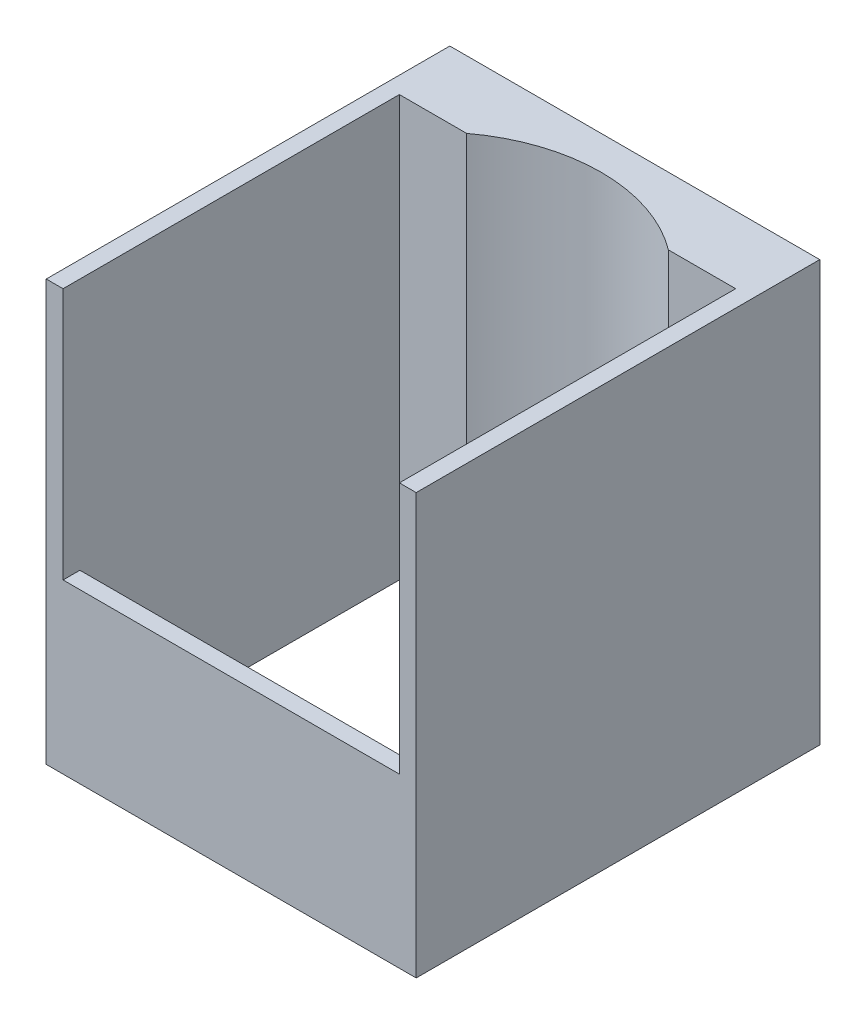
from build123d import *

# Parameters (mm, degrees)
SKETCH1_W                      = 670
SKETCH1_H                      = 120
BOSS_EXTRUDE1_DEPTH            = 530
SKETCH2_W                      = 100
SKETCH2_H                      = 200
SKETCH2_W_2                    = 650
SKETCH2_H_2                    = 250
CUT_EXTRUDE1_DEPTH             = 100
SKETCH3_R                      = 50
CUT_EXTRUDE2_DEPTH             = 260
F_12_0_12_DIAMETER_HOLE2_D     = 12
F_12_0_12_DIAMETER_HOLE2_DEPTH = 30
F_12_0_12_DIAMETER_HOLE2_TIP   = 3.605163714
SKETCH8_W                      = 650
SKETCH8_H                      = 50
BOSS_EXTRUDE2_DEPTH            = 5
SKETCH9_W                      = 10
SKETCH9_H                      = 250
CUT_EXTRUDE3_DEPTH             = 717
CUT_EXTRUDE4_DEPTH             = 5
SKETCH11_W                     = 10
SKETCH11_H                     = 100
BOSS_EXTRUDE3_DEPTH            = 78
BOSS_EXTRUDE3_2_DEPTH          = 78
BOSS_EXTRUDE3_3_DEPTH          = 78
SKETCH12_W                     = 20
SKETCH12_H                     = 30
CUT_EXTRUDE5_DEPTH             = 80
SKETCH15_W                     = 30
SKETCH15_H                     = 23.536156656
SKETCH15_H_2                   = 28.986603691
CUT_EXTRUDE7_DEPTH             = 35
SHELL1_T                       = -3
SKETCH16_W                     = 14
SKETCH16_H                     = 14
CUT_EXTRUDE8_DEPTH             = 35
SKETCH17_W                     = 5.729882812
SKETCH17_H                     = 17.428393554
SKETCH17_W_2                   = 13.369726562
SKETCH17_H_2                   = 3.342431641
BOSS_EXTRUDE4_DEPTH            = 5
SKETCH18_W                     = 670
SKETCH18_H                     = 280
CUT_EXTRUDE10_DEPTH            = 159
CUT_EXTRUDE11_DEPTH            = 863.670273187
CUT_EXTRUDE11_DEPTH_BACK       = 863.670273187
SKETCH19_W                     = 115
SKETCH19_H                     = 250
SKETCH19_W_2                   = 445
CUT_EXTRUDE12_DEPTH            = 589.153891426
CUT_EXTRUDE12_DEPTH_BACK       = 589.153891426
SKETCH20_W                     = 110
SKETCH20_H                     = 125


with BuildPart() as part:
    # Sketch1 → Boss-Extrude1 (new body)
    with BuildSketch(Plane(origin=(0, 0, 0), x_dir=(1, 0, 0), z_dir=(0, 1, 0))):
        with Locations((335, 60)):
            Rectangle(SKETCH1_W, SKETCH1_H)
    extrude(amount=BOSS_EXTRUDE1_DEPTH)

    # Sketch2 → Cut-Extrude1 (cut)
    with BuildSketch(Plane.XY):
        with Locations((60, 380)):
            Rectangle(SKETCH2_W, SKETCH2_H)
        with Locations((170, 380)):
            Rectangle(SKETCH2_W, SKETCH2_H)
        with Locations((280, 380)):
            Rectangle(SKETCH2_W, SKETCH2_H)
        with Locations((390, 380)):
            Rectangle(SKETCH2_W, SKETCH2_H)
        with Locations((500, 380)):
            Rectangle(SKETCH2_W, SKETCH2_H)
        with Locations((610, 380)):
            Rectangle(SKETCH2_W, SKETCH2_H)
        with Locations((335, 135)):
            Rectangle(SKETCH2_W_2, SKETCH2_H_2)
    extrude(amount=-CUT_EXTRUDE1_DEPTH, mode=Mode.SUBTRACT)

    # Sketch3 → Cut-Extrude2 (cut)
    with BuildSketch(Plane(origin=(0, 530, 0), x_dir=(1, 0, 0), z_dir=(0, 1, 0))):
        with Locations(Location((60, 60, 0), (0, 0, 270))):
            Circle(SKETCH3_R)
        with Locations(Location((170, 60, 0), (0, 0, 270))):
            Circle(SKETCH3_R)
        with Locations(Location((280, 60, 0), (0, 0, 270))):
            Circle(SKETCH3_R)
        with Locations(Location((390, 60, 0), (0, 0, 270))):
            Circle(SKETCH3_R)
        with Locations(Location((500, 60, 0), (0, 0, 270))):
            Circle(SKETCH3_R)
        with Locations(Location((610, 60, 0), (0, 0, 270))):
            Circle(SKETCH3_R)
    extrude(amount=-CUT_EXTRUDE2_DEPTH, mode=Mode.SUBTRACT)

    # Ø12.0 (12) Diameter Hole2
    with Locations(Plane(origin=(59.704642413, 270, -102.411697903), x_dir=(0, 0, 1), z_dir=(0, 1, 0))):
        with Locations((0, 0), (-0.195888006, 111.8520513), (0.014838595, 221.167624818), (-0.341843303, 331.364008353), (0.657723149, 441.008646429), (1.288998006, 549.811854685)):
            Hole(F_12_0_12_DIAMETER_HOLE2_D / 2, depth=F_12_0_12_DIAMETER_HOLE2_DEPTH)
            with Locations((0, 0, -(F_12_0_12_DIAMETER_HOLE2_DEPTH + F_12_0_12_DIAMETER_HOLE2_TIP / 2))):  # 118° drill point
                Cone(0, F_12_0_12_DIAMETER_HOLE2_D / 2, F_12_0_12_DIAMETER_HOLE2_TIP, mode=Mode.SUBTRACT)

    # Sketch8 → Boss-Extrude2 (add)
    with BuildSketch(Plane.XY):
        with Locations((335, 305)):
            Rectangle(SKETCH8_W, SKETCH8_H)
    extrude(amount=-BOSS_EXTRUDE2_DEPTH)

    # Sketch9 → Cut-Extrude3 (cut)
    with BuildSketch(Plane(origin=(670, 0, 0), x_dir=(0, 0, -1), z_dir=(1, 0, 0))):
        with Locations((15, 135)):
            Rectangle(SKETCH9_W, SKETCH9_H)
    extrude(amount=-CUT_EXTRUDE3_DEPTH, mode=Mode.SUBTRACT)

    # Sketch10 → Cut-Extrude4 (cut)
    with BuildSketch(Plane(origin=(0, 10, 0), x_dir=(1, 0, 0), z_dir=(0, 1, 0))):
        Polygon((365, 61.943560596), (350, 87.924322709), (320, 87.924322709), (305, 61.943560596), (320, 35.962798482), (350, 35.962798482), align=None)
    extrude(amount=-CUT_EXTRUDE4_DEPTH, mode=Mode.SUBTRACT)

    # Sketch12 → Cut-Extrude5 (cut)
    with BuildSketch(Plane.XY.offset(-100)):
        with Locations((85.198613037, 245)):
            Rectangle(SKETCH12_W, SKETCH12_H)
        with Locations((195.198613037, 245)):
            Rectangle(SKETCH12_W, SKETCH12_H)
        with Locations((305.198613037, 245)):
            Rectangle(SKETCH12_W, SKETCH12_H)
        with Locations((415.198613037, 245)):
            Rectangle(SKETCH12_W, SKETCH12_H)
        with Locations((525.198613037, 245)):
            Rectangle(SKETCH12_W, SKETCH12_H)
        with Locations((635.198613037, 245)):
            Rectangle(SKETCH12_W, SKETCH12_H)
    extrude(amount=-CUT_EXTRUDE5_DEPTH, mode=Mode.SUBTRACT)

    # Sketch17 → Boss-Extrude4 (add)
    # profile 1 of 9: a face of its own
    with BuildSketch(Plane.XY):
        with BuildLine():
            Line((527.508830928, 289.835452458), (527.508830928, 307.263846012))
            Line((527.508830928, 307.263846012), (534.861434459, 307.263846012))
            add(Edge.make_bspline(
                [(534.861434459, 307.263846012), (535.181337774, 307.258256848), (535.803061116, 307.24739446), (536.703508491, 307.139069344), (537.544992916, 306.975202489), (538.325061607, 306.737496792), (539.040841948, 306.426020155), (539.698044515, 306.051894954), (540.290333057, 305.605079277), (540.822348212, 305.090232636), (541.284521701, 304.502523111), (541.692171296, 303.852565801), (542.030284458, 303.129762281), (542.309377095, 302.341316546), (542.5243908, 301.484161689), (542.679660381, 300.560045938), (542.773357357, 299.567500804), (542.783368073, 298.883107022), (542.788518428, 298.530997273)],
                knots=[0, 0, 0, 0, 1.135059408, 2.20595691, 3.214417064, 4.174978569, 5.094187092, 5.980001006, 6.853065862, 7.720814779, 8.600404634, 9.50058483, 10.438414914, 11.426825708, 12.465239141, 13.571113463, 14.750376389, 16, 16, 16, 16], degree=3))
            add(Edge.make_bspline(
                [(542.788518428, 298.530997273), (542.781740751, 298.180151665), (542.768592871, 297.499553336), (542.676885992, 296.511518461), (542.516733301, 295.591080531), (542.296748778, 294.736450427), (542.003051046, 293.953120444), (541.654236167, 293.233205539), (541.233025793, 292.585291498), (540.753136904, 292.000029304), (540.204772188, 291.484681411), (539.587651059, 291.044279297), (538.910779309, 290.668464036), (538.169670382, 290.361903209), (537.364073889, 290.124869172), (536.495133477, 289.954199984), (535.562644449, 289.853487388), (534.920131033, 289.841584621), (534.58911581, 289.835452458)],
                knots=[0, 0, 0, 0, 1.228418252, 2.382983832, 3.470276728, 4.496757894, 5.468023682, 6.394867725, 7.292157164, 8.167372942, 9.039072913, 9.918728341, 10.815246345, 11.744296628, 12.720973084, 13.750736166, 14.841206188, 16, 16, 16, 16], degree=3))
            Line((534.58911581, 289.835452458), (527.508830928, 289.835452458))
        make_face()
        with BuildLine():
            Line((533.238713741, 291.745413395), (534.048208904, 291.745413395))
            add(Edge.make_bspline(
                [(534.048208904, 291.745413395), (534.172894012, 291.749291978), (534.413033311, 291.756761998), (534.758676231, 291.825976613), (535.075745017, 291.938271137), (535.365749176, 292.094802589), (535.623404602, 292.300450923), (535.848862806, 292.551404902), (536.04776914, 292.844737637), (536.217685755, 293.190205032), (536.364284647, 293.596533622), (536.481764702, 294.076367921), (536.592118304, 294.630928744), (536.673672739, 295.265507643), (536.740044562, 295.978448886), (536.788346679, 296.768428292), (536.812018936, 297.636801208), (536.817188964, 298.241258393), (536.819890499, 298.55711002)],
                knots=[0, 0, 0, 0, 0.728710832, 1.403472396, 2.052289494, 2.690292559, 3.321919393, 3.970736491, 4.656696891, 5.388631723, 6.217040872, 7.17856157, 8.275589967, 9.523440737, 10.918935818, 12.463926104, 14.152268318, 16, 16, 16, 16], degree=3))
            add(Edge.make_bspline(
                [(536.819890499, 298.55711002), (536.8171426, 298.871715251), (536.811863063, 299.476166083), (536.7886758, 300.343334385), (536.739579947, 301.133216935), (536.674703848, 301.843934916), (536.589660404, 302.476324031), (536.488366458, 303.031681737), (536.362441588, 303.507627045), (536.222158727, 303.914921549), (536.050140993, 304.256514038), (535.858357073, 304.554097881), (535.62547107, 304.79746827), (535.36991257, 305.004888479), (535.079348843, 305.160875844), (534.761320266, 305.273944358), (534.414185903, 305.34216807), (534.172870641, 305.349893944), (534.048208904, 305.353885075)],
                knots=[0, 0, 0, 0, 1.842836665, 3.540640921, 5.080358154, 6.47765669, 7.719902824, 8.816971715, 9.781579111, 10.601733135, 11.334613876, 12.017393917, 12.666641099, 13.29908421, 13.937911793, 14.587567384, 15.270347425, 16, 16, 16, 16], degree=3))
            Line((534.048208904, 305.353885075), (533.238713741, 305.353885075))
            Line((533.238713741, 305.353885075), (533.238713741, 291.745413395))
        make_face(mode=Mode.SUBTRACT)
    # profile 2 of 9: a face of its own
    with BuildSketch(Plane.XY):
        with Locations((547.563420772, 298.549649235)):
            Rectangle(SKETCH17_W, SKETCH17_H)
    # profile 3 of 9: a face of its own
    with BuildSketch(Plane.XY):
        Polygon((564.514324092, 307.263846012), (564.514324092, 305.115139958), (558.545696163, 305.115139958), (558.545696163, 299.862747379), (563.559343624, 299.862747379), (563.559343624, 297.714041325), (558.545696163, 297.714041325), (558.545696163, 289.835452458), (552.81581335, 289.835452458), (552.81581335, 307.263846012), align=None)
    # profile 4 of 9: a face of its own
    with BuildSketch(Plane.XY):
        Polygon((577.645305538, 307.263846012), (577.645305538, 305.115139958), (571.676677608, 305.115139958), (571.676677608, 299.862747379), (576.690325069, 299.862747379), (576.690325069, 297.714041325), (571.676677608, 297.714041325), (571.676677608, 289.835452458), (565.946794795, 289.835452458), (565.946794795, 307.263846012), align=None)
    # profile 5 of 9: a face of its own
    with BuildSketch(Plane.XY):
        with Locations((584.330168819, 287.448001286)):
            Rectangle(SKETCH17_W_2, SKETCH17_H_2)
    # profile 6 of 9: a face of its own
    with BuildSketch(Plane.XY):
        with BuildLine():
            Line((605.578484249, 307.263846012), (605.578484249, 295.602639195))
            add(Edge.make_bspline(
                [(605.578484249, 295.602639195), (605.574209777, 295.35989389), (605.565919345, 294.889083964), (605.480877158, 294.20653885), (605.349958188, 293.569747554), (605.15926554, 292.978838165), (604.911867049, 292.436847071), (604.616163877, 291.936663973), (604.260702644, 291.487723021), (603.847299908, 291.08966617), (603.386881991, 290.731670113), (602.867295001, 290.425440037), (602.293741958, 290.168488385), (601.66690529, 289.960990771), (600.988052682, 289.797299786), (600.254912883, 289.679078851), (599.467035781, 289.60781007), (598.923618241, 289.60048219), (598.643684673, 289.59670734)],
                knots=[0, 0, 0, 0, 1.108173197, 2.149326602, 3.136215123, 4.073726706, 4.978516626, 5.852185058, 6.72141202, 7.584905625, 8.467554395, 9.379216169, 10.332422268, 11.332766067, 12.390653242, 13.518530507, 14.721707419, 16, 16, 16, 16], degree=3))
            add(Edge.make_bspline(
                [(598.643684673, 289.59670734), (598.373688491, 289.600411437), (597.851346557, 289.607577482), (597.093280473, 289.679448684), (596.387523889, 289.797736542), (595.733050135, 289.960122315), (595.130189942, 290.169220301), (594.579048171, 290.42623041), (594.078350789, 290.732835498), (593.633858028, 291.090104794), (593.234289459, 291.486851767), (592.899913678, 291.940746827), (592.609043638, 292.435866034), (592.375223767, 292.980322997), (592.191754821, 293.570441519), (592.063541006, 294.20666921), (591.983676196, 294.889343196), (591.974661767, 295.359932437), (591.970012569, 295.602639195)],
                knots=[0, 0, 0, 0, 1.258901956, 2.435505865, 3.547148904, 4.59359074, 5.576649289, 6.5183682, 7.424469602, 8.307507093, 9.172751023, 10.042627298, 10.928839176, 11.845659241, 12.799442865, 13.80597989, 14.868432463, 16, 16, 16, 16], degree=3))
            Line((591.970012569, 295.602639195), (591.970012569, 307.263846012))
            Line((591.970012569, 307.263846012), (597.699895381, 307.263846012))
            Line((597.699895381, 307.263846012), (597.699895381, 295.457153889))
            add(Edge.make_bspline(
                [(597.699895381, 295.457153889), (597.700816195, 295.287996189), (597.702584578, 294.963135903), (597.729908723, 294.499051493), (597.768241004, 294.079064133), (597.828226169, 293.705517832), (597.90066041, 293.377063412), (597.989882091, 293.09281535), (598.094998068, 292.852496478), (598.225239063, 292.654232043), (598.380826623, 292.495135011), (598.55368342, 292.353231761), (598.757556996, 292.238543846), (598.987648905, 292.146224908), (599.243380948, 292.070549638), (599.526120553, 292.020376099), (599.83553351, 291.990763905), (600.049971942, 291.986424568), (600.161954402, 291.984158512)],
                knots=[0, 0, 0, 0, 1.622370975, 3.115695595, 4.458049099, 5.666011203, 6.742434742, 7.681714947, 8.519814998, 9.250928664, 9.942747364, 10.646898194, 11.389596108, 12.175933929, 13.021386247, 13.943159715, 14.925891993, 16, 16, 16, 16], degree=3))
            add(Edge.make_bspline(
                [(600.161954402, 291.984158512), (600.283927219, 291.987190593), (600.521124756, 291.993087005), (600.86597014, 292.03390861), (601.187714881, 292.103380086), (601.484890424, 292.205377303), (601.758665297, 292.332852529), (602.012761516, 292.484567923), (602.236391413, 292.674631152), (602.439076761, 292.888441291), (602.620738276, 293.128529789), (602.771757722, 293.399928575), (602.905501548, 293.697121508), (603.005823683, 294.025060118), (603.089837826, 294.379999499), (603.146989706, 294.763086929), (603.186210275, 295.174074524), (603.189394751, 295.457053988), (603.191033077, 295.602639195)],
                knots=[0, 0, 0, 0, 1.083870311, 2.107775948, 3.08105344, 4.003637981, 4.893545291, 5.761570557, 6.624657808, 7.49233129, 8.376387281, 9.291996285, 10.246843261, 11.267344133, 12.334180325, 13.486053461, 14.706643157, 16, 16, 16, 16], degree=3))
            Line((603.191033077, 295.602639195), (603.191033077, 307.263846012))
            Line((603.191033077, 307.263846012), (605.578484249, 307.263846012))
        make_face()
    # profile 7 of 9: a face of its own
    with BuildSketch(Plane.XY):
        with BuildLine():
            Line((619.731593227, 302.015183827), (616.739818477, 301.526502415))
            add(Edge.make_bspline(
                [(616.739818477, 301.526502415), (616.748849224, 301.670726223), (616.765660669, 301.939210177), (616.78429066, 302.312269209), (616.796668381, 302.625642376), (616.798628236, 302.814722915), (616.799504756, 302.899286839)],
                knots=[0, 0, 0, 0, 1.261802504, 2.348944521, 3.261585937, 4, 4, 4, 4], degree=3))
            add(Edge.make_bspline(
                [(616.799504756, 302.899286839), (616.798306068, 303.007660677), (616.795968139, 303.219033721), (616.750451916, 303.523894877), (616.694806916, 303.811547356), (616.604352699, 304.076787391), (616.488181329, 304.320314265), (616.348943917, 304.543955606), (616.184187178, 304.745078709), (615.995833421, 304.928129987), (615.778009957, 305.083200131), (615.536269472, 305.218702836), (615.269765326, 305.333844758), (614.978065514, 305.431346685), (614.660683072, 305.504624438), (614.319025281, 305.556776695), (613.952471696, 305.585673441), (613.699597795, 305.590260771), (613.568984889, 305.592630192)],
                knots=[0, 0, 0, 0, 1.079280541, 2.105035848, 3.067950317, 3.99715044, 4.889989748, 5.753421302, 6.617030865, 7.476358039, 8.364190572, 9.274590025, 10.235106994, 11.254473582, 12.337095886, 13.478601727, 14.697662529, 16, 16, 16, 16], degree=3))
            add(Edge.make_bspline(
                [(613.568984889, 305.592630192), (613.391954632, 305.58912286), (613.059112606, 305.582528579), (612.595688488, 305.495339748), (612.198743126, 305.361419257), (611.87165349, 305.163811893), (611.613188167, 304.909795747), (611.433841092, 304.593316589), (611.323009072, 304.224665915), (611.313400221, 303.959558324), (611.308367061, 303.820693775)],
                knots=[0, 0, 0, 0, 1.294917039, 2.43462794, 3.440028966, 4.347597256, 5.210608309, 6.06356377, 6.985685997, 8, 8, 8, 8], degree=3))
            add(Edge.make_bspline(
                [(611.308367061, 303.820693775), (611.317562032, 303.705133219), (611.336106628, 303.472068433), (611.47315858, 303.132808312), (611.695999602, 302.811560885), (612.009295906, 302.510664216), (612.404107796, 302.221967273), (612.884407504, 301.948533431), (613.450813789, 301.688189695), (613.862519081, 301.536023727), (614.080048656, 301.455624958)],
                knots=[0, 0, 0, 0, 0.716839541, 1.445735977, 2.240793036, 3.131329288, 4.131129903, 5.273471266, 6.559404876, 8, 8, 8, 8], degree=3))
            add(Edge.make_bspline(
                [(614.080048656, 301.455624958), (614.335934702, 301.364918412), (614.834564244, 301.188164095), (615.547657928, 300.88707802), (616.213068388, 300.5749594), (616.829579094, 300.246613346), (617.397833174, 299.90520698), (617.914851624, 299.544556457), (618.386199073, 299.173962102), (618.807001026, 298.783874588), (619.177995113, 298.378100064), (619.4958685, 297.952745357), (619.771807525, 297.51723103), (619.991113975, 297.061458502), (620.169645242, 296.594624218), (620.292698657, 296.11024444), (620.364288243, 295.609761088), (620.37516617, 295.270864226), (620.380681514, 295.099036213)],
                knots=[0, 0, 0, 0, 1.359488612, 2.649152603, 3.874964776, 5.039588756, 6.146130126, 7.193090393, 8.194917302, 9.146793662, 10.063845301, 10.944476293, 11.803344532, 12.641736646, 13.473440096, 14.302714936, 15.139439897, 16, 16, 16, 16], degree=3))
            add(Edge.make_bspline(
                [(620.380681514, 295.099036213), (620.374476075, 294.902306495), (620.362285176, 294.515820995), (620.280160209, 293.948630617), (620.138011896, 293.409496554), (619.938489338, 292.895972278), (619.681049879, 292.411946655), (619.366518754, 291.954381076), (618.996510229, 291.525099427), (618.5710008, 291.128381035), (618.102222518, 290.765302239), (617.587803957, 290.450854345), (617.034458515, 290.187092261), (616.444107988, 289.968993032), (615.81453624, 289.801373099), (615.145337453, 289.685291013), (614.438790193, 289.606619894), (613.954683001, 289.600062276), (613.70700941, 289.59670734)],
                knots=[0, 0, 0, 0, 0.972121714, 1.909782367, 2.824924061, 3.721832975, 4.62620438, 5.527836938, 6.46026819, 7.421000932, 8.398101015, 9.385579713, 10.394244048, 11.422703992, 12.491421888, 13.608778581, 14.776629625, 16, 16, 16, 16], degree=3))
            add(Edge.make_bspline(
                [(613.70700941, 289.59670734), (613.445745367, 289.599650312), (612.939893069, 289.605348413), (612.207608113, 289.66709241), (611.525297432, 289.760984454), (610.893395078, 289.899706116), (610.309273131, 290.072394336), (609.776099392, 290.288320955), (609.295310255, 290.547303481), (608.863217672, 290.843007892), (608.478306623, 291.175775461), (608.148120946, 291.551766865), (607.86942369, 291.967163224), (607.639947144, 292.421521488), (607.466477665, 292.917583541), (607.339164663, 293.449829748), (607.264537999, 294.021332449), (607.254747521, 294.414908557), (607.249700069, 294.617815586)],
                knots=[0, 0, 0, 0, 1.342201143, 2.598733168, 3.773451092, 4.878874364, 5.91991243, 6.900006476, 7.829142054, 8.72062616, 9.585588575, 10.436728592, 11.283829734, 12.149664931, 13.044964919, 13.977937424, 14.957531465, 16, 16, 16, 16], degree=3))
            add(Edge.make_bspline(
                [(607.249700069, 294.617815586), (607.250803815, 294.692425759), (607.253213998, 294.855347393), (607.260452266, 295.122772538), (607.275636683, 295.433682216), (607.29037174, 295.656130545), (607.298195171, 295.774237248)],
                knots=[0, 0, 0, 0, 0.773500207, 1.689044709, 2.77302154, 4, 4, 4, 4], degree=3))
            Line((607.298195171, 295.774237248), (610.36457777, 296.337526509))
            add(Edge.make_bspline(
                [(610.36457777, 296.337526509), (610.326952988, 296.136337493), (610.255606535, 295.754830366), (610.178678473, 295.21219969), (610.124206629, 294.733311493), (610.11767002, 294.435147371), (610.114641475, 294.297001835)],
                knots=[0, 0, 0, 0, 1.192988372, 2.262218769, 3.194850416, 4, 4, 4, 4], degree=3))
            add(Edge.make_bspline(
                [(610.114641475, 294.297001835), (610.116191817, 294.183708768), (610.119182568, 293.965156219), (610.159053378, 293.648552813), (610.215988606, 293.352999663), (610.302906772, 293.079707227), (610.411206928, 292.826307836), (610.544682453, 292.59538211), (610.704385489, 292.386485019), (610.887496571, 292.200099922), (611.094689168, 292.033628705), (611.327456494, 291.892756696), (611.58347653, 291.771733922), (611.864681562, 291.677479524), (612.167961721, 291.596080628), (612.497219749, 291.548235723), (612.849461228, 291.512043782), (613.092629543, 291.508500084), (613.218327999, 291.506668278)],
                knots=[0, 0, 0, 0, 1.135776692, 2.191015738, 3.19649269, 4.151244236, 5.061952528, 5.956281389, 6.819534407, 7.692823504, 8.571441916, 9.478554956, 10.416037156, 11.406231466, 12.450054172, 13.561596327, 14.739541482, 16, 16, 16, 16], degree=3))
            add(Edge.make_bspline(
                [(613.218327999, 291.506668278), (613.423996012, 291.510791273), (613.810619321, 291.518541853), (614.349272542, 291.616708407), (614.810575885, 291.768742445), (615.189785268, 291.991387532), (615.490778961, 292.278756613), (615.698005174, 292.637320004), (615.824813318, 293.05638326), (615.837728413, 293.355975238), (615.844524288, 293.513619419)],
                knots=[0, 0, 0, 0, 1.308765556, 2.460272085, 3.475015317, 4.388076298, 5.239673503, 6.095681635, 6.997954785, 8, 8, 8, 8], degree=3))
            add(Edge.make_bspline(
                [(615.844524288, 293.513619419), (615.833808824, 293.638242951), (615.811807312, 293.894126055), (615.644884004, 294.264515838), (615.382382362, 294.620631473), (615.016807277, 294.962984909), (614.551376589, 295.293471235), (613.986957743, 295.616730224), (613.322148235, 295.933112033), (612.83677959, 296.119639164), (612.580430889, 296.21815395)],
                knots=[0, 0, 0, 0, 0.667930748, 1.371427933, 2.146459016, 3.034714139, 4.04893387, 5.207327294, 6.525042705, 8, 8, 8, 8], degree=3))
            add(Edge.make_bspline(
                [(612.580430889, 296.21815395), (612.374354345, 296.29679374), (611.970646869, 296.450850434), (611.394079385, 296.713586304), (610.853066711, 296.987016804), (610.357486361, 297.288235735), (609.896382561, 297.599610528), (609.477036946, 297.932256792), (609.09841673, 298.284556341), (608.758710772, 298.653375077), (608.457302107, 299.038989264), (608.199448649, 299.444659231), (607.977533299, 299.866789834), (607.798609588, 300.308107488), (607.65975715, 300.767821241), (607.559616231, 301.244439392), (607.497905054, 301.739995674), (607.491630423, 302.075933546), (607.488445186, 302.246468159)],
                knots=[0, 0, 0, 0, 1.249558333, 2.447906163, 3.58867143, 4.682264114, 5.731748367, 6.739728761, 7.711906036, 8.659384707, 9.578321416, 10.481344598, 11.379544271, 12.277135726, 13.175418307, 14.097160112, 15.034047388, 16, 16, 16, 16], degree=3))
            add(Edge.make_bspline(
                [(607.488445186, 302.246468159), (607.49282555, 302.439538736), (607.501402184, 302.817565692), (607.587451154, 303.36980586), (607.719291893, 303.894921371), (607.910558542, 304.389343064), (608.156192894, 304.852853762), (608.453187669, 305.288766511), (608.804241719, 305.697593471), (609.213503754, 306.066686531), (609.657214714, 306.407618241), (610.14376173, 306.697651931), (610.658716537, 306.950861947), (611.210636666, 307.148827868), (611.791820619, 307.313252612), (612.408080529, 307.421140415), (613.056315391, 307.490701612), (613.499160755, 307.498567824), (613.725661373, 307.502591129)],
                knots=[0, 0, 0, 0, 1.01033566, 1.978209831, 2.919499157, 3.840961976, 4.746855014, 5.660740114, 6.597989116, 7.56120833, 8.541877795, 9.523498025, 10.522416858, 11.542172371, 12.589598349, 13.681636521, 14.814234488, 16, 16, 16, 16], degree=3))
            add(Edge.make_bspline(
                [(613.725661373, 307.502591129), (613.968269855, 307.498219033), (614.438190994, 307.489750488), (615.120391152, 307.426787419), (615.755073228, 307.319142339), (616.345153155, 307.171557286), (616.887304575, 306.977590666), (617.384933999, 306.742393454), (617.834452216, 306.46201507), (618.236961315, 306.139451502), (618.593086714, 305.773322851), (618.897467704, 305.361641069), (619.158701245, 304.909408454), (619.366684143, 304.412232174), (619.529870326, 303.873247147), (619.649133834, 303.29158184), (619.720420497, 302.667301443), (619.72779778, 302.236712324), (619.731593227, 302.015183827)],
                knots=[0, 0, 0, 0, 1.248314423, 2.417925914, 3.521398822, 4.558068205, 5.543720209, 6.479599284, 7.385061127, 8.263440163, 9.127722873, 10.00561236, 10.891325273, 11.808802823, 12.772251995, 13.784947978, 14.860405143, 16, 16, 16, 16], degree=3))
        make_face()
    # profile 8 of 9: a face of its own
    with BuildSketch(Plane.XY):
        Polygon((633.989153194, 307.263846012), (633.989153194, 305.115139958), (628.020525264, 305.115139958), (628.020525264, 300.340237614), (633.034172725, 300.340237614), (633.034172725, 298.191531559), (628.020525264, 298.191531559), (628.020525264, 291.984158512), (634.944133663, 291.984158512), (634.944133663, 289.835452458), (622.290642452, 289.835452458), (622.290642452, 307.263846012), align=None)
    # profile 9 of 9: a face of its own
    with BuildSketch(Plane.XY):
        with BuildLine():
            Line((636.376604366, 289.835452458), (636.376604366, 307.263846012))
            Line((636.376604366, 307.263846012), (643.990335369, 307.263846012))
            add(Edge.make_bspline(
                [(643.990335369, 307.263846012), (644.237946498, 307.261150834), (644.721600887, 307.25588639), (645.426490561, 307.189203683), (646.094808274, 307.090496236), (646.724915796, 306.949857504), (647.317873659, 306.767252686), (647.871119087, 306.542146), (648.390701058, 306.282329135), (648.864494846, 305.976472528), (649.295093616, 305.642889252), (649.669668547, 305.279483604), (649.990389523, 304.894749072), (650.250664962, 304.483256345), (650.454275633, 304.048690948), (650.59581384, 303.587791605), (650.684089268, 303.104102537), (650.695510601, 302.772834174), (650.701311397, 302.604585835)],
                knots=[0, 0, 0, 0, 1.303269877, 2.545653735, 3.724355284, 4.8584284, 5.941462088, 6.987020715, 8.000098032, 8.995332524, 9.951400474, 10.863507538, 11.737823931, 12.582415999, 13.420128714, 14.25671499, 15.114600608, 16, 16, 16, 16], degree=3))
            add(Edge.make_bspline(
                [(650.701311397, 302.604585835), (650.698282873, 302.472674957), (650.692382063, 302.215658276), (650.651041486, 301.838684287), (650.580643818, 301.480313933), (650.481036683, 301.139915259), (650.347814833, 300.820175594), (650.191279492, 300.517863507), (650.009772227, 300.230553342), (649.788675198, 299.970497982), (649.548268341, 299.722842359), (649.274558803, 299.497116911), (648.974487035, 299.288655528), (648.642526299, 299.104010513), (648.287619671, 298.928055749), (647.899038177, 298.784921972), (647.486819978, 298.644749395), (647.19793098, 298.577036306), (647.049257183, 298.54218845)],
                knots=[0, 0, 0, 0, 1.057156483, 2.059775939, 3.035078039, 3.981068617, 4.897189472, 5.80650904, 6.70770952, 7.613691521, 8.536886357, 9.470937334, 10.45233069, 11.461024139, 12.51295332, 13.623444893, 14.776929983, 16, 16, 16, 16], degree=3))
            add(Edge.make_bspline(
                [(647.049257183, 298.54218845), (647.19164695, 298.499279419), (647.467865022, 298.416041346), (647.856360945, 298.265600017), (648.211652989, 298.111536308), (648.524185739, 297.936781388), (648.807636894, 297.762122504), (649.047122259, 297.564301324), (649.255235567, 297.361673563), (649.425188343, 297.135464734), (649.570253643, 296.882344437), (649.694827156, 296.586596707), (649.815179167, 296.247423665), (649.917667348, 295.859098311), (650.004750555, 295.423699276), (650.088222437, 294.944027189), (650.153853601, 294.416024546), (650.187587341, 294.048412906), (650.2051692, 293.856815525)],
                knots=[0, 0, 0, 0, 1.149282524, 2.229462177, 3.219229774, 4.139917433, 4.995948464, 5.788695735, 6.536448429, 7.236319808, 7.968460079, 8.78645307, 9.713791991, 10.749194692, 11.887975363, 13.146018663, 14.512518948, 16, 16, 16, 16], degree=3))
            add(Edge.make_bspline(
                [(650.2051692, 293.856815525), (650.225980287, 293.627849833), (650.265975604, 293.187817268), (650.348933081, 292.554613589), (650.44386163, 291.974357025), (650.555874504, 291.44528724), (650.681301216, 290.967898855), (650.821280597, 290.540469593), (650.979920039, 290.165788217), (651.10484481, 289.941461656), (651.163880062, 289.835452458)],
                knots=[0, 0, 0, 0, 1.324580516, 2.545615266, 3.678710841, 4.711533017, 5.660403917, 6.521349952, 7.301239649, 8, 8, 8, 8], degree=3))
            Line((651.163880062, 289.835452458), (645.213904094, 289.835452458))
            add(Edge.make_bspline(
                [(645.213904094, 289.835452458), (645.12229736, 290.069847279), (644.935171241, 290.548648246), (644.7595281, 291.319414791), (644.64846922, 292.142514735), (644.635117598, 292.70994511), (644.628232479, 293.002555653)],
                knots=[0, 0, 0, 0, 0.930410518, 1.900560147, 2.917368081, 4, 4, 4, 4], degree=3))
            Line((644.628232479, 293.002555653), (644.605850124, 294.002300831))
            Line((644.605850124, 294.002300831), (644.579737377, 295.266903874))
            add(Edge.make_bspline(
                [(644.579737377, 295.266903874), (644.573694669, 295.477395004), (644.562357007, 295.872330118), (644.469348432, 296.426164013), (644.30178735, 296.894645884), (644.073222546, 297.287223005), (643.766741442, 297.590613479), (643.39104803, 297.804152917), (642.950456912, 297.93396284), (642.634664848, 297.946292392), (642.468335247, 297.952786442)],
                knots=[0, 0, 0, 0, 1.295300309, 2.430314163, 3.439929415, 4.342995669, 5.203512789, 6.060756153, 6.978588463, 8, 8, 8, 8], degree=3))
            Line((642.468335247, 297.952786442), (642.106487178, 297.952786442))
            Line((642.106487178, 297.952786442), (642.106487178, 289.835452458))
            Line((642.106487178, 289.835452458), (636.376604366, 289.835452458))
        make_face()
        with BuildLine():
            Line((642.106487178, 299.862747379), (642.617550945, 299.862747379))
            add(Edge.make_bspline(
                [(642.617550945, 299.862747379), (642.722054451, 299.865172716), (642.925280724, 299.869889229), (643.220054897, 299.898289891), (643.494111408, 299.951809873), (643.749840966, 300.021017819), (643.984372137, 300.114851792), (644.200147241, 300.225818296), (644.391160406, 300.362685327), (644.565327067, 300.516342321), (644.718148635, 300.691986294), (644.850351299, 300.889034217), (644.961199162, 301.106225057), (645.056078491, 301.342818683), (645.125883912, 301.600830857), (645.173262731, 301.879472914), (645.203404658, 302.177423605), (645.207875435, 302.383174491), (645.210173702, 302.488943669)],
                knots=[0, 0, 0, 0, 1.184986479, 2.304423995, 3.352332712, 4.347714965, 5.303263624, 6.211353909, 7.091434645, 7.960150225, 8.839440182, 9.723126897, 10.64371617, 11.599264829, 12.608232147, 13.667459739, 14.800924404, 16, 16, 16, 16], degree=3))
            add(Edge.make_bspline(
                [(645.210173702, 302.488943669), (645.207875435, 302.594712847), (645.203404658, 302.800463732), (645.173262731, 303.098414423), (645.125883912, 303.37705648), (645.056078491, 303.635068654), (644.961199162, 303.87166228), (644.850351299, 304.08885312), (644.718148635, 304.285901043), (644.565327067, 304.461545017), (644.391160406, 304.61520201), (644.200147241, 304.752069041), (643.984372137, 304.863035546), (643.749840966, 304.956869518), (643.494111408, 305.026077464), (643.220054897, 305.079597446), (642.925280724, 305.107998108), (642.722054451, 305.112714621), (642.617550945, 305.115139958)],
                knots=[0, 0, 0, 0, 1.199075596, 2.332540261, 3.391767853, 4.400735171, 5.35628383, 6.276873103, 7.160559818, 8.039849775, 8.908565355, 9.788646091, 10.696736376, 11.652285035, 12.647667288, 13.695576005, 14.815013521, 16, 16, 16, 16], degree=3))
            Line((642.617550945, 305.115139958), (642.106487178, 305.115139958))
            Line((642.106487178, 305.115139958), (642.106487178, 299.862747379))
        make_face(mode=Mode.SUBTRACT)
    extrude(amount=BOSS_EXTRUDE4_DEPTH)


with BuildPart() as body_2:
    # Sketch11 → Boss-Extrude3 (new body)
    with BuildSketch(Plane.XY.offset(-100)):
        with Locations((255, 60)):
            Rectangle(SKETCH11_W, SKETCH11_H)
    extrude(amount=BOSS_EXTRUDE3_DEPTH)


with BuildPart() as body_3:
    # Sketch11 → Boss-Extrude3 2 (new body)
    with BuildSketch(Plane.XY.offset(-100)):
        with Locations((415, 60)):
            Rectangle(SKETCH11_W, SKETCH11_H)
    extrude(amount=BOSS_EXTRUDE3_2_DEPTH)


with BuildPart() as body_4:
    # Sketch11 → Boss-Extrude3 3 (new body)
    with BuildSketch(Plane.XY.offset(-100)):
        Polygon((25, 198.45686471), (325, 145.558770497), (325, 122.01775856), (345, 122.01775856), (345, 145.558770497), (645, 198.45686471), align=None)
    extrude(amount=BOSS_EXTRUDE3_3_DEPTH)

    # Sketch15 → Cut-Extrude7 (cut)
    with BuildSketch(Plane(origin=(345, 0, 0), x_dir=(0, 0, -1), z_dir=(1, 0, 0))):
        with Locations((35, 133.231921672)):
            Rectangle(SKETCH15_W, SKETCH15_H)
        with Locations((85, 130.506698154)):
            Rectangle(SKETCH15_W, SKETCH15_H_2)
    extrude(amount=-CUT_EXTRUDE7_DEPTH, mode=Mode.SUBTRACT)

    # Shell1
    shell1_openings = [body_4.faces().sort_by_distance(p)[0] for p in [
        (335, 198.45686471, -61),
    ]]
    offset(amount=SHELL1_T, openings=shell1_openings, kind=Kind.INTERSECTION)

    # Sketch16 → Cut-Extrude8 (cut)
    with BuildSketch(Plane.XZ.offset(-122.01775856)):
        with Locations((335, -60)):
            Rectangle(SKETCH16_W, SKETCH16_H)
    extrude(amount=-CUT_EXTRUDE8_DEPTH, mode=Mode.SUBTRACT)


with BuildPart() as cut_extrude10_tool:
    # Sketch18 → Cut-Extrude10 (new body)
    with BuildSketch(Plane.XY):
        with Locations((335, 140)):
            Rectangle(SKETCH18_W, SKETCH18_H)
    extrude(amount=-CUT_EXTRUDE10_DEPTH)


with BuildPart() as part_1:
    add(part.part)

    # Cut-Extrude10: cut by cut_extrude10_tool
    add(cut_extrude10_tool.part, mode=Mode.SUBTRACT)

    # Sketch19 → Cut-Extrude11 (cut, two sides: drawn at the far end of the back side and taken through both)
    with BuildSketch(Plane.XY.offset(-CUT_EXTRUDE11_DEPTH_BACK)):
        with Locations((57.5, 405)):
            Rectangle(SKETCH19_W, SKETCH19_H)
        with Locations((447.5, 405)):
            Rectangle(SKETCH19_W_2, SKETCH19_H)
    extrude(amount=CUT_EXTRUDE11_DEPTH + CUT_EXTRUDE11_DEPTH_BACK, mode=Mode.SUBTRACT)

    # Sketch20 → Cut-Extrude12 (cut, two sides: drawn at the far end of the back side and taken through both)
    with BuildSketch(Plane.XY.offset(-CUT_EXTRUDE12_DEPTH_BACK)):
        with Locations((170, 467.5)):
            Rectangle(SKETCH20_W, SKETCH20_H)
    extrude(amount=CUT_EXTRUDE12_DEPTH + CUT_EXTRUDE12_DEPTH_BACK, mode=Mode.SUBTRACT)


with BuildPart() as body_2_1:
    add(body_2.part)

    # Cut-Extrude10: cut by cut_extrude10_tool
    add(cut_extrude10_tool.part, mode=Mode.SUBTRACT)


with BuildPart() as body_3_1:
    add(body_3.part)

    # Cut-Extrude10: cut by cut_extrude10_tool
    add(cut_extrude10_tool.part, mode=Mode.SUBTRACT)


with BuildPart() as body_4_1:
    add(body_4.part)

    # Cut-Extrude10: cut by cut_extrude10_tool
    add(cut_extrude10_tool.part, mode=Mode.SUBTRACT)


solid = part_1.part
